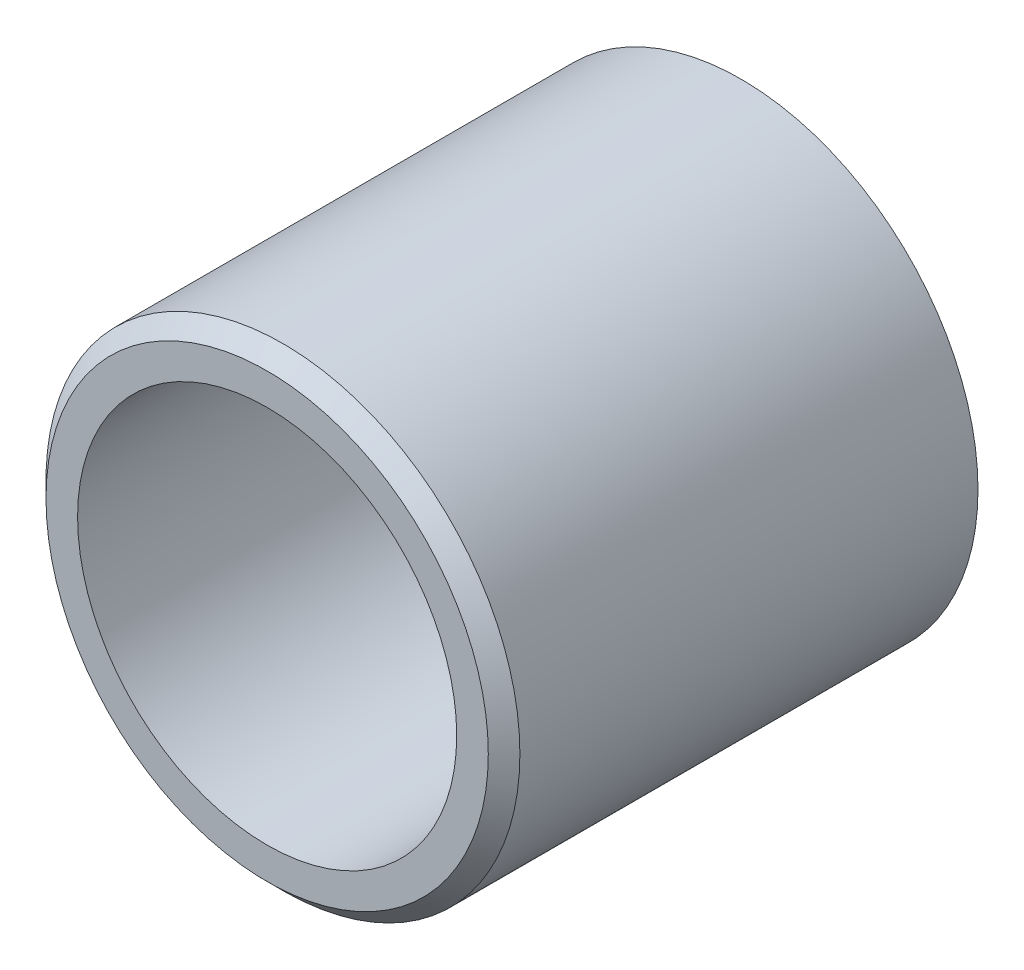
from build123d import *

# Parameters (mm, degrees)
SKETCH1_R           = 7.5
SKETCH1_R_2         = 6
BOSS_EXTRUDE1_DEPTH = 15
CHAMFER2_SIZE       = 0.5


with BuildPart() as part:
    # Sketch1 → Boss-Extrude1 (new body)
    with BuildSketch(Plane.XY):
        Circle(SKETCH1_R)
        Circle(SKETCH1_R_2, mode=Mode.SUBTRACT)
    extrude(amount=BOSS_EXTRUDE1_DEPTH)

    # Chamfer2
    chamfer2_edges = [part.edges().sort_by_distance(p)[0] for p in [
        (-7.5, 0, 15),
    ]]
    chamfer(chamfer2_edges, length=CHAMFER2_SIZE)


solid = part.part
